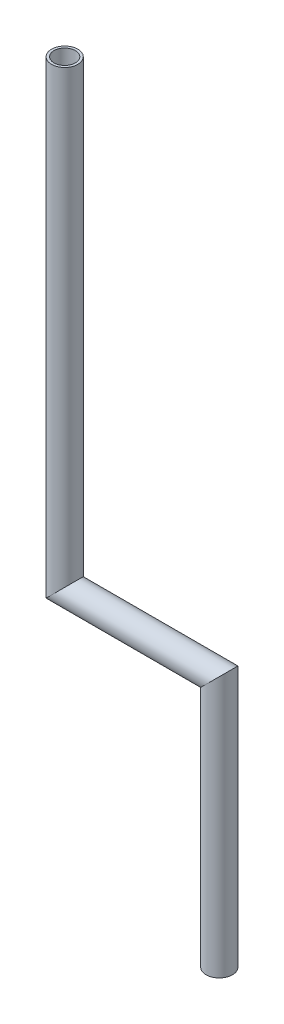
from build123d import *

# Parameters (mm, degrees)
SKETCH2_R   = 8.590298432
SKETCH2_R_2 = 6.98382971


with BuildPart() as part:
    # Sweep1: sweep along a path in Sketch1
    with BuildLine(Plane.XY) as sweep1_path:
        Line((0, 300), (0, 0))
        Line((0, 0), (100.948472845, 0))
        Line((100.948472845, 0), (100.948472845, -164.279132507))
    # Sketch2 → Sweep1 (sweep)
    with BuildSketch(Plane(origin=(0, 300, 0), x_dir=(1, 0, 0), z_dir=(0, 1, 0))):
        Circle(SKETCH2_R)
        Circle(SKETCH2_R_2, mode=Mode.SUBTRACT)
    sweep(path=sweep1_path.line, transition=Transition.RIGHT)


solid = part.part
